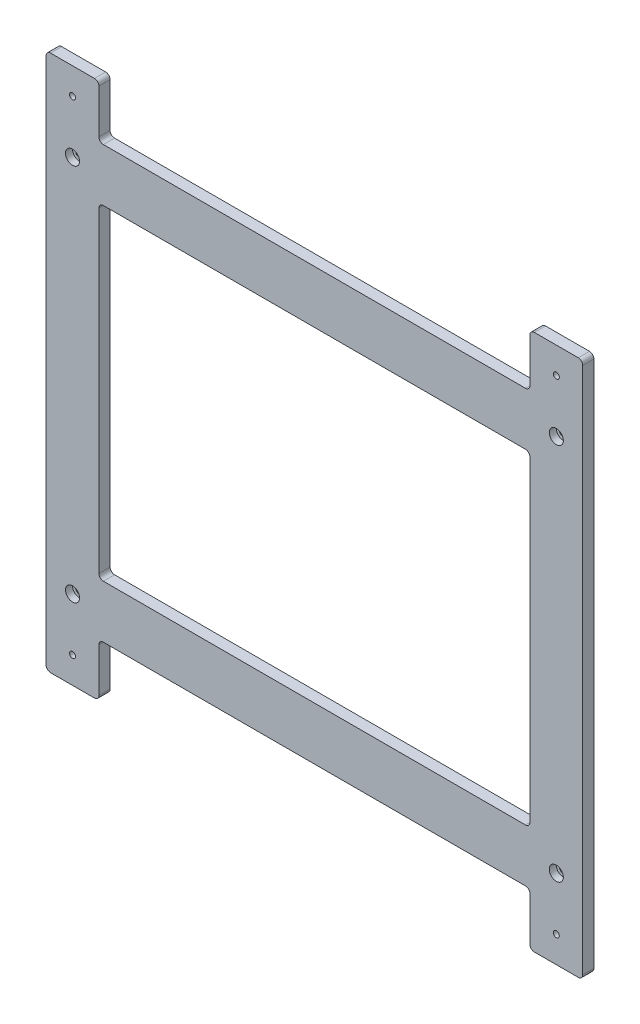
from build123d import *

# Parameters (mm, degrees)
BOSS_EXTRUDE1_DEPTH            = 6.35
CBORE_FOR_M4_SHCS1_D           = 4.5
CBORE_FOR_M4_SHCS1_CBORE_D     = 8
CBORE_FOR_M4_SHCS1_CBORE_DEPTH = 4
M3_CLEARANCE_HOLE2_D           = 3.4


with BuildPart() as part:
    # Sketch7 → Boss-Extrude1 (new body)
    with BuildSketch(Plane.XY):
        with BuildLine():
            Line((-119.9, -122.4), (119.9, -122.4))
            ThreePointArc((119.9, -122.4), (121.667766953, -123.132233047), (122.4, -124.9))
            Line((122.4, -124.9), (122.4, -149.9))
            ThreePointArc((122.4, -149.9), (123.132233047, -151.667766953), (124.9, -152.4))
            Line((124.9, -152.4), (149.9, -152.4))
            ThreePointArc((149.9, -152.4), (151.667766953, -151.667766953), (152.4, -149.9))
            Line((152.4, -149.9), (152.4, -102.186961883))
            Line((152.4, -102.186961883), (152.4, 120.74319893))
            Line((152.4, 120.74319893), (152.4, 149.9))
            ThreePointArc((152.4, 149.9), (151.667766953, 151.667766953), (149.9, 152.4))
            Line((149.9, 152.4), (124.9, 152.4))
            ThreePointArc((124.9, 152.4), (123.132233047, 151.667766953), (122.4, 149.9))
            Line((122.4, 149.9), (122.4, 124.9))
            ThreePointArc((122.4, 124.9), (121.667766953, 123.132233047), (119.9, 122.4))
            Line((119.9, 122.4), (-119.9, 122.4))
            ThreePointArc((-119.9, 122.4), (-121.667766953, 123.132233047), (-122.4, 124.9))
            Line((-122.4, 124.9), (-122.4, 149.9))
            ThreePointArc((-122.4, 149.9), (-123.132233047, 151.667766953), (-124.9, 152.4))
            Line((-124.9, 152.4), (-149.9, 152.4))
            ThreePointArc((-149.9, 152.4), (-151.667766953, 151.667766953), (-152.4, 149.9))
            Line((-152.4, 149.9), (-152.4, 102.186961883))
            Line((-152.4, 102.186961883), (-152.4, -120.74319893))
            Line((-152.4, -120.74319893), (-152.4, -149.9))
            ThreePointArc((-152.4, -149.9), (-151.667766953, -151.667766953), (-149.9, -152.4))
            Line((-149.9, -152.4), (-124.9, -152.4))
            ThreePointArc((-124.9, -152.4), (-123.132233047, -151.667766953), (-122.4, -149.9))
            Line((-122.4, -149.9), (-122.4, -124.9))
            ThreePointArc((-122.4, -124.9), (-121.667766953, -123.132233047), (-119.9, -122.4))
        make_face()
        with BuildLine():
            Line((-119.9, -92.4), (119.9, -92.4))
            ThreePointArc((119.9, -92.4), (121.667766953, -91.667766953), (122.4, -89.9))
            Line((122.4, -89.9), (122.4, 89.9))
            ThreePointArc((122.4, 89.9), (121.667766953, 91.667766953), (119.9, 92.4))
            Line((119.9, 92.4), (-119.9, 92.4))
            ThreePointArc((-119.9, 92.4), (-121.667766953, 91.667766953), (-122.4, 89.9))
            Line((-122.4, 89.9), (-122.4, -89.9))
            ThreePointArc((-122.4, -89.9), (-121.667766953, -91.667766953), (-119.9, -92.4))
        make_face(mode=Mode.SUBTRACT)
    extrude(amount=BOSS_EXTRUDE1_DEPTH)

    # CBORE for M4 SHCS1 (through all)
    with Locations(Plane.XY.offset(6.35)):
        with Locations((-137.4, 107.4), (-137.4, -107.4), (137.4, -107.4), (137.4, 107.4)):
            CounterBoreHole(CBORE_FOR_M4_SHCS1_D / 2, CBORE_FOR_M4_SHCS1_CBORE_D / 2, CBORE_FOR_M4_SHCS1_CBORE_DEPTH)

    # M3 Clearance Hole2 (through all)
    with Locations(Plane.XY.offset(6.35)):
        with Locations((-137.4, 137.4), (137.4, 137.4), (137.4, -137.4), (-137.4, -137.4)):
            Hole(M3_CLEARANCE_HOLE2_D / 2)


solid = part.part
